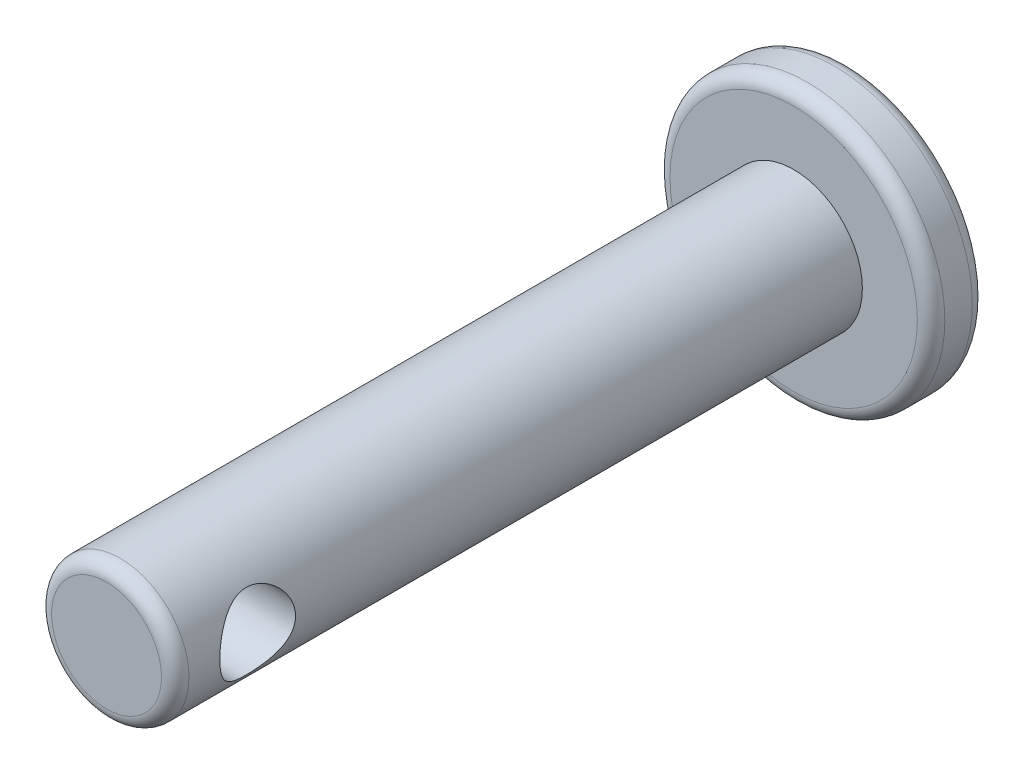
from build123d import *

# Parameters (mm, degrees)
SKETCH1_R               = 3.175
BOSS_EXTRUDE1_DEPTH     = 31.75
SKETCH2_R               = 6.35
BOSS_EXTRUDE2_DEPTH     = 2.54
CUT_EXTRUDE1_DEPTH      = 33.995567884
CUT_EXTRUDE1_DEPTH_BACK = 33.995567884
SKETCH3_R               = 1.75
FILLET2_R               = 0.635


with BuildPart() as part:
    # Sketch1 → Boss-Extrude1 (new body)
    with BuildSketch(Plane.XY):
        Circle(SKETCH1_R)
    extrude(amount=BOSS_EXTRUDE1_DEPTH)

    # Sketch2 → Boss-Extrude2 (add)
    with BuildSketch(Plane(origin=(0, 0, 0), x_dir=(-1, 0, 0), z_dir=(0, 0, -1))):
        Circle(SKETCH2_R)
    extrude(amount=BOSS_EXTRUDE2_DEPTH)

    # Sketch3 → Cut-Extrude1 (cut, two sides: drawn at the far end of the back side and taken through both)
    with BuildSketch(Plane(origin=(0, 0, 0), x_dir=(0, 0, -1), z_dir=(1, 0, 0)).offset(-CUT_EXTRUDE1_DEPTH_BACK)):
        with Locations(Location((-27.94, 0, 0), (0, 0, 180.000000003))):
            Circle(SKETCH3_R)
    extrude(amount=CUT_EXTRUDE1_DEPTH + CUT_EXTRUDE1_DEPTH_BACK, mode=Mode.SUBTRACT)

    # Fillet2
    fillet2_edges = [part.edges().sort_by_distance(p)[0] for p in [
        (-3.175, 0, 31.75),
        (6.35, 0, 0),
        (6.35, 0, -2.54),
    ]]
    fillet(fillet2_edges, radius=FILLET2_R)


solid = part.part
